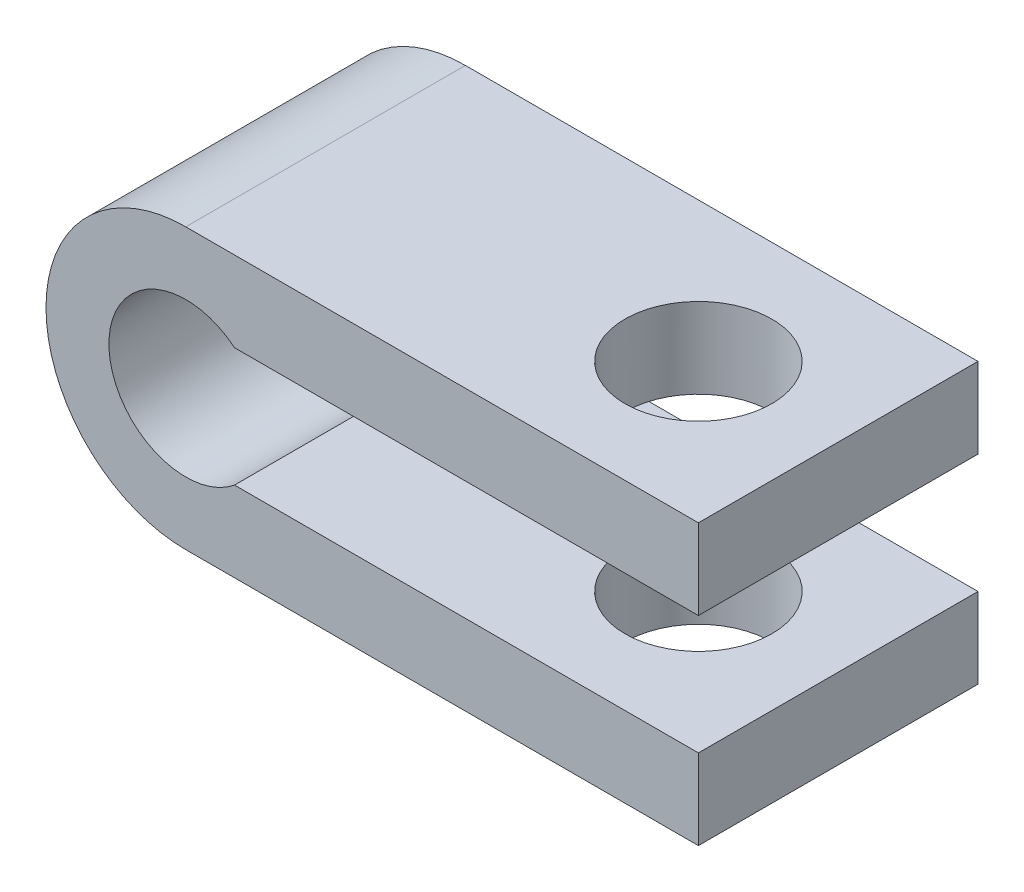
from build123d import *

# Parameters (mm, degrees)
BOSS_EXTRUDE1_DEPTH     = 12
CUT_EXTRUDE1_DEPTH      = 26.768197453
CUT_EXTRUDE1_DEPTH_BACK = 26.768197453
SKETCH2_R               = 3.15


with BuildPart() as part:
    # Sketch1 → Boss-Extrude1 (new body)
    with BuildSketch(Plane.XY):
        with BuildLine():
            Line((0, 6), (22, 6))
            Line((22, 6), (22, 2.552710574))
            Line((22, 2.552710574), (2.091331807, 2.552710574))
            ThreePointArc((2.091331807, 2.552710574), (-3.3, 0), (2.091331807, -2.552710574))
            Line((2.091331807, -2.552710574), (22, -2.552710574))
            Line((22, -2.552710574), (22, -6))
            Line((22, -6), (0, -6))
            ThreePointArc((0, -6), (-6, 0), (0, 6))
        make_face()
    extrude(amount=BOSS_EXTRUDE1_DEPTH)

    # Sketch2 → Cut-Extrude1 (cut, two sides: drawn at the far end of the back side and taken through both)
    with BuildSketch(Plane(origin=(0, 0, 0), x_dir=(1, 0, 0), z_dir=(0, 1, 0)).offset(-CUT_EXTRUDE1_DEPTH_BACK)):
        with Locations(Location((16, -6, 0), (0, 0, 270))):
            Circle(SKETCH2_R)
    extrude(amount=CUT_EXTRUDE1_DEPTH + CUT_EXTRUDE1_DEPTH_BACK, mode=Mode.SUBTRACT)


solid = part.part
